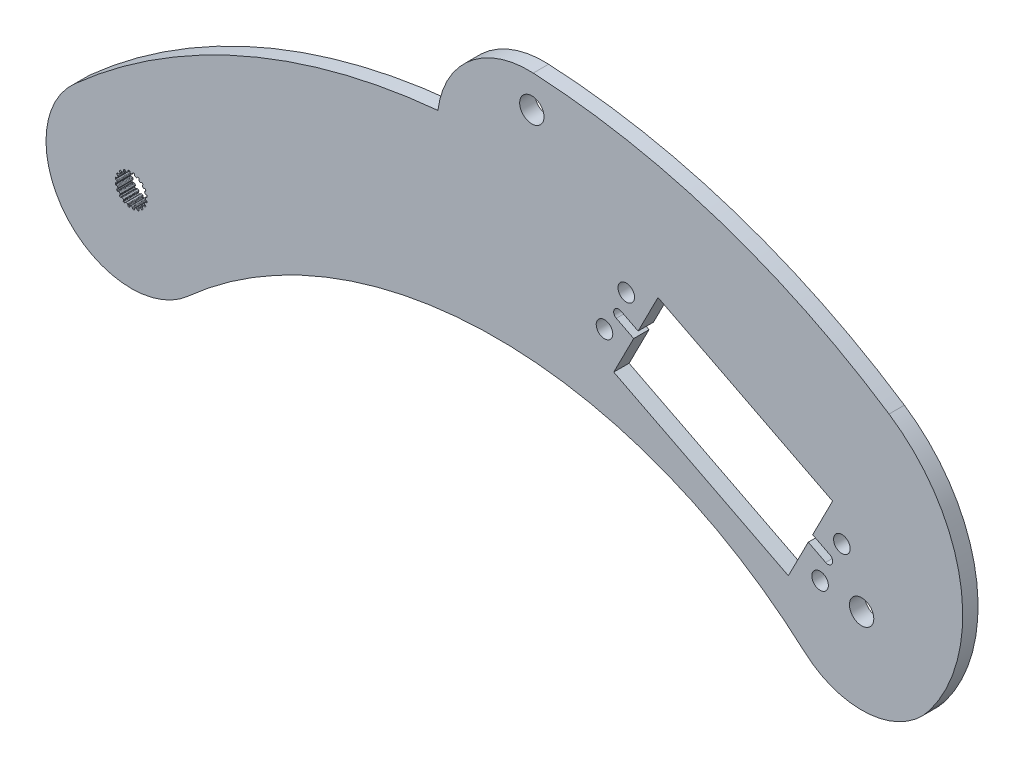
from build123d import *

# Parameters (mm, degrees)
BOSS_EXTRUDE1_DEPTH = 3.2004
SKETCH2_R           = 1.7272
SKETCH2_R_2         = 2.54
CUT_EXTRUDE1_DEPTH  = 3.2004
CUT_EXTRUDE2_DEPTH  = 3.2004
BOSS_EXTRUDE2_START = -3.2004
SKETCH4_R           = 2.54
BOSS_EXTRUDE2_DEPTH = 3.2004


with BuildPart() as part:
    # Sketch1 → Boss-Extrude1 (new body)
    with BuildSketch(Plane.XY):
        with BuildLine():
            ThreePointArc((-11.875315661, 13.236894431), (76.2, 46.954576728), (164.275315661, 13.236894431))
            ThreePointArc((164.275315661, 13.236894431), (165.636894431, -11.875315661), (140.524684339, -13.236894431))
            ThreePointArc((140.524684339, -13.236894431), (76.2, 11.388385128), (11.875315661, -13.236894431))
            ThreePointArc((11.875315661, -13.236894431), (-13.236894431, -11.875315661), (-11.875315661, 13.236894431))
        make_face()
        with BuildLine():
            Line((-0.106949245, 2.969874934), (0.106949245, 2.969874934))
            ThreePointArc((0.106949245, 2.969874934), (0.196343213, 2.986924176), (0.253739238, 3.057547504))
            Line((0.253739238, 3.057547504), (0.315888147, 3.237526941))
            ThreePointArc((0.315888147, 3.237526941), (0.359032156, 3.298322911), (0.4281449, 3.326269005))
            Line((0.4281449, 3.326269005), (0.620027588, 3.2937547))
            ThreePointArc((0.620027588, 3.2937547), (0.689621142, 3.24802576), (0.718272212, 3.169836791))
            Line((0.718272212, 3.169836791), (0.724389167, 2.979527391))
            ThreePointArc((0.724389167, 2.979527391), (0.750934762, 2.9040661), (0.816027049, 2.857568043))
            Line((0.816027049, 2.857568043), (1.019456602, 2.791469774))
            ThreePointArc((1.019456602, 2.791469774), (1.109743823, 2.780060312), (1.186154496, 2.829490741))
            Line((1.186154496, 2.829490741), (1.300878326, 2.981456288))
            ThreePointArc((1.300878326, 2.981456288), (1.360697704, 3.02594446), (1.435063648, 3.031165762))
            Line((1.435063648, 3.031165762), (1.607507455, 2.940947809))
            ThreePointArc((1.607507455, 2.940947809), (1.659563839, 2.875951412), (1.662650905, 2.792735615))
            Line((1.662650905, 2.792735615), (1.609659636, 2.609850378))
            ThreePointArc((1.609659636, 2.609850378), (1.611587176, 2.529879385), (1.659124931, 2.465542482))
            Line((1.659124931, 2.465542482), (1.832172444, 2.339816104))
            ThreePointArc((1.832172444, 2.339816104), (1.914514976, 2.301064775), (2.002460687, 2.32446371))
            Line((2.002460687, 2.32446371), (2.158529469, 2.433539921))
            ThreePointArc((2.158529469, 2.433539921), (2.229168681, 2.457365482), (2.301508367, 2.439350895))
            Line((2.301508367, 2.439350895), (2.437633293, 2.300260456))
            ThreePointArc((2.437633293, 2.300260456), (2.467056864, 2.222358901), (2.444277744, 2.14226202))
            Line((2.444277744, 2.14226202), (2.337365406, 1.984703026))
            ThreePointArc((2.337365406, 1.984703026), (2.314486209, 1.908050449), (2.339816104, 1.832172444))
            Line((2.339816104, 1.832172444), (2.465542482, 1.659124931))
            ThreePointArc((2.465542482, 1.659124931), (2.531880064, 1.596824985), (2.622752074, 1.591901975))
            Line((2.622752074, 1.591901975), (2.804888709, 1.64741171))
            ThreePointArc((2.804888709, 1.64741171), (2.879433095, 1.648242449), (2.942665411, 1.608755366))
            Line((2.942665411, 1.608755366), (3.0291466, 1.434407582))
            ThreePointArc((3.0291466, 1.434407582), (3.033057175, 1.351226417), (2.986641646, 1.282088892))
            Line((2.986641646, 1.282088892), (2.836273564, 1.165279113))
            ThreePointArc((2.836273564, 1.165279113), (2.790827206, 1.099448241), (2.791469774, 1.019456602))
            Line((2.791469774, 1.019456602), (2.857568043, 0.816027049))
            ThreePointArc((2.857568043, 0.816027049), (2.901407091, 0.736276839), (2.986310214, 0.703513784))
            Line((2.986310214, 0.703513784), (3.1766859, 0.700023363))
            ThreePointArc((3.1766859, 0.700023363), (3.247838536, 0.677777961), (3.295773863, 0.620683653))
            Line((3.295773863, 0.620683653), (3.324145932, 0.4281449))
            ThreePointArc((3.324145932, 0.4281449), (3.302160717, 0.347826477), (3.236652255, 0.29641597))
            Line((3.236652255, 0.29641597), (3.057547504, 0.231789562))
            ThreePointArc((3.057547504, 0.231789562), (2.993982591, 0.183224379), (2.969874934, 0.106949245))
            Line((2.969874934, 0.106949245), (2.969874934, -0.106949245))
            ThreePointArc((2.969874934, -0.106949245), (2.986924176, -0.196343213), (3.057547504, -0.253739238))
            Line((3.057547504, -0.253739238), (3.237526941, -0.315888147))
            ThreePointArc((3.237526941, -0.315888147), (3.298322911, -0.359032156), (3.326269005, -0.4281449))
            Line((3.326269005, -0.4281449), (3.2937547, -0.620027588))
            ThreePointArc((3.2937547, -0.620027588), (3.24802576, -0.689621142), (3.169836791, -0.718272212))
            Line((3.169836791, -0.718272212), (2.979527391, -0.724389167))
            ThreePointArc((2.979527391, -0.724389167), (2.9040661, -0.750934762), (2.857568043, -0.816027049))
            Line((2.857568043, -0.816027049), (2.791469774, -1.019456602))
            ThreePointArc((2.791469774, -1.019456602), (2.780060312, -1.109743823), (2.829490741, -1.186154496))
            Line((2.829490741, -1.186154496), (2.981456288, -1.300878326))
            ThreePointArc((2.981456288, -1.300878326), (3.02594446, -1.360697704), (3.031165762, -1.435063648))
            Line((3.031165762, -1.435063648), (2.940947809, -1.607507455))
            ThreePointArc((2.940947809, -1.607507455), (2.875951412, -1.659563839), (2.792735615, -1.662650905))
            Line((2.792735615, -1.662650905), (2.609850378, -1.609659636))
            ThreePointArc((2.609850378, -1.609659636), (2.529879385, -1.611587176), (2.465542482, -1.659124931))
            Line((2.465542482, -1.659124931), (2.339816104, -1.832172444))
            ThreePointArc((2.339816104, -1.832172444), (2.301064775, -1.914514976), (2.32446371, -2.002460687))
            Line((2.32446371, -2.002460687), (2.433539921, -2.158529469))
            ThreePointArc((2.433539921, -2.158529469), (2.457365482, -2.229168681), (2.439350895, -2.301508367))
            Line((2.439350895, -2.301508367), (2.300260456, -2.437633293))
            ThreePointArc((2.300260456, -2.437633293), (2.222358901, -2.467056864), (2.14226202, -2.444277744))
            Line((2.14226202, -2.444277744), (1.984703026, -2.337365406))
            ThreePointArc((1.984703026, -2.337365406), (1.908050449, -2.314486209), (1.832172444, -2.339816104))
            Line((1.832172444, -2.339816104), (1.659124931, -2.465542482))
            ThreePointArc((1.659124931, -2.465542482), (1.596824985, -2.531880064), (1.591901975, -2.622752074))
            Line((1.591901975, -2.622752074), (1.64741171, -2.804888709))
            ThreePointArc((1.64741171, -2.804888709), (1.648242449, -2.879433095), (1.608755366, -2.942665411))
            Line((1.608755366, -2.942665411), (1.434407582, -3.0291466))
            ThreePointArc((1.434407582, -3.0291466), (1.351226417, -3.033057175), (1.282088892, -2.986641646))
            Line((1.282088892, -2.986641646), (1.165279113, -2.836273564))
            ThreePointArc((1.165279113, -2.836273564), (1.099448241, -2.790827206), (1.019456602, -2.791469774))
            Line((1.019456602, -2.791469774), (0.816027049, -2.857568043))
            ThreePointArc((0.816027049, -2.857568043), (0.736276839, -2.901407091), (0.703513784, -2.986310214))
            Line((0.703513784, -2.986310214), (0.700023363, -3.1766859))
            ThreePointArc((0.700023363, -3.1766859), (0.677777961, -3.247838536), (0.620683653, -3.295773863))
            Line((0.620683653, -3.295773863), (0.4281449, -3.324145932))
            ThreePointArc((0.4281449, -3.324145932), (0.347826477, -3.302160717), (0.29641597, -3.236652255))
            Line((0.29641597, -3.236652255), (0.231789562, -3.057547504))
            ThreePointArc((0.231789562, -3.057547504), (0.183224379, -2.993982591), (0.106949245, -2.969874934))
            Line((0.106949245, -2.969874934), (-0.106949245, -2.969874934))
            ThreePointArc((-0.106949245, -2.969874934), (-0.196343213, -2.986924176), (-0.253739238, -3.057547504))
            Line((-0.253739238, -3.057547504), (-0.315888147, -3.237526941))
            ThreePointArc((-0.315888147, -3.237526941), (-0.359032156, -3.298322911), (-0.4281449, -3.326269005))
            Line((-0.4281449, -3.326269005), (-0.620027588, -3.2937547))
            ThreePointArc((-0.620027588, -3.2937547), (-0.689621142, -3.24802576), (-0.718272212, -3.169836791))
            Line((-0.718272212, -3.169836791), (-0.724389167, -2.979527391))
            ThreePointArc((-0.724389167, -2.979527391), (-0.750934762, -2.9040661), (-0.816027049, -2.857568043))
            Line((-0.816027049, -2.857568043), (-1.019456602, -2.791469774))
            ThreePointArc((-1.019456602, -2.791469774), (-1.109743823, -2.780060312), (-1.186154496, -2.829490741))
            Line((-1.186154496, -2.829490741), (-1.300878326, -2.981456288))
            ThreePointArc((-1.300878326, -2.981456288), (-1.360697704, -3.02594446), (-1.435063648, -3.031165762))
            Line((-1.435063648, -3.031165762), (-1.607507455, -2.940947809))
            ThreePointArc((-1.607507455, -2.940947809), (-1.659563839, -2.875951412), (-1.662650905, -2.792735615))
            Line((-1.662650905, -2.792735615), (-1.609659636, -2.609850378))
            ThreePointArc((-1.609659636, -2.609850378), (-1.611587176, -2.529879385), (-1.659124931, -2.465542482))
            Line((-1.659124931, -2.465542482), (-1.832172444, -2.339816104))
            ThreePointArc((-1.832172444, -2.339816104), (-1.914514976, -2.301064775), (-2.002460687, -2.32446371))
            Line((-2.002460687, -2.32446371), (-2.158529469, -2.433539921))
            ThreePointArc((-2.158529469, -2.433539921), (-2.229168681, -2.457365482), (-2.301508367, -2.439350895))
            Line((-2.301508367, -2.439350895), (-2.437633293, -2.300260456))
            ThreePointArc((-2.437633293, -2.300260456), (-2.467056864, -2.222358901), (-2.444277744, -2.14226202))
            Line((-2.444277744, -2.14226202), (-2.337365406, -1.984703026))
            ThreePointArc((-2.337365406, -1.984703026), (-2.314486209, -1.908050449), (-2.339816104, -1.832172444))
            Line((-2.339816104, -1.832172444), (-2.465542482, -1.659124931))
            ThreePointArc((-2.465542482, -1.659124931), (-2.531880064, -1.596824985), (-2.622752074, -1.591901975))
            Line((-2.622752074, -1.591901975), (-2.804888709, -1.64741171))
            ThreePointArc((-2.804888709, -1.64741171), (-2.879433095, -1.648242449), (-2.942665411, -1.608755366))
            Line((-2.942665411, -1.608755366), (-3.0291466, -1.434407582))
            ThreePointArc((-3.0291466, -1.434407582), (-3.033057175, -1.351226417), (-2.986641646, -1.282088892))
            Line((-2.986641646, -1.282088892), (-2.836273564, -1.165279113))
            ThreePointArc((-2.836273564, -1.165279113), (-2.790827206, -1.099448241), (-2.791469774, -1.019456602))
            Line((-2.791469774, -1.019456602), (-2.857568043, -0.816027049))
            ThreePointArc((-2.857568043, -0.816027049), (-2.901407091, -0.736276839), (-2.986310214, -0.703513784))
            Line((-2.986310214, -0.703513784), (-3.1766859, -0.700023363))
            ThreePointArc((-3.1766859, -0.700023363), (-3.247838536, -0.677777961), (-3.295773863, -0.620683653))
            Line((-3.295773863, -0.620683653), (-3.324145932, -0.4281449))
            ThreePointArc((-3.324145932, -0.4281449), (-3.302160717, -0.347826477), (-3.236652255, -0.29641597))
            Line((-3.236652255, -0.29641597), (-3.057547504, -0.231789562))
            ThreePointArc((-3.057547504, -0.231789562), (-2.993982591, -0.183224379), (-2.969874934, -0.106949245))
            Line((-2.969874934, -0.106949245), (-2.969874934, 0.106949245))
            ThreePointArc((-2.969874934, 0.106949245), (-2.986924176, 0.196343213), (-3.057547504, 0.253739238))
            Line((-3.057547504, 0.253739238), (-3.237526941, 0.315888147))
            ThreePointArc((-3.237526941, 0.315888147), (-3.298322911, 0.359032156), (-3.326269005, 0.4281449))
            Line((-3.326269005, 0.4281449), (-3.2937547, 0.620027588))
            ThreePointArc((-3.2937547, 0.620027588), (-3.24802576, 0.689621142), (-3.169836791, 0.718272212))
            Line((-3.169836791, 0.718272212), (-2.979527391, 0.724389167))
            ThreePointArc((-2.979527391, 0.724389167), (-2.9040661, 0.750934762), (-2.857568043, 0.816027049))
            Line((-2.857568043, 0.816027049), (-2.791469774, 1.019456602))
            ThreePointArc((-2.791469774, 1.019456602), (-2.780060312, 1.109743823), (-2.829490741, 1.186154496))
            Line((-2.829490741, 1.186154496), (-2.981456288, 1.300878326))
            ThreePointArc((-2.981456288, 1.300878326), (-3.02594446, 1.360697704), (-3.031165762, 1.435063648))
            Line((-3.031165762, 1.435063648), (-2.940947809, 1.607507455))
            ThreePointArc((-2.940947809, 1.607507455), (-2.875951412, 1.659563839), (-2.792735615, 1.662650905))
            Line((-2.792735615, 1.662650905), (-2.609850378, 1.609659636))
            ThreePointArc((-2.609850378, 1.609659636), (-2.529879385, 1.611587176), (-2.465542482, 1.659124931))
            Line((-2.465542482, 1.659124931), (-2.339816104, 1.832172444))
            ThreePointArc((-2.339816104, 1.832172444), (-2.301064775, 1.914514976), (-2.32446371, 2.002460687))
            Line((-2.32446371, 2.002460687), (-2.433539921, 2.158529469))
            ThreePointArc((-2.433539921, 2.158529469), (-2.457365482, 2.229168681), (-2.439350895, 2.301508367))
            Line((-2.439350895, 2.301508367), (-2.300260456, 2.437633293))
            ThreePointArc((-2.300260456, 2.437633293), (-2.222358901, 2.467056864), (-2.14226202, 2.444277744))
            Line((-2.14226202, 2.444277744), (-1.984703026, 2.337365406))
            ThreePointArc((-1.984703026, 2.337365406), (-1.908050449, 2.314486209), (-1.832172444, 2.339816104))
            Line((-1.832172444, 2.339816104), (-1.659124931, 2.465542482))
            ThreePointArc((-1.659124931, 2.465542482), (-1.596824985, 2.531880064), (-1.591901975, 2.622752074))
            Line((-1.591901975, 2.622752074), (-1.64741171, 2.804888709))
            ThreePointArc((-1.64741171, 2.804888709), (-1.648242449, 2.879433095), (-1.608755366, 2.942665411))
            Line((-1.608755366, 2.942665411), (-1.434407582, 3.0291466))
            ThreePointArc((-1.434407582, 3.0291466), (-1.351226417, 3.033057175), (-1.282088892, 2.986641646))
            Line((-1.282088892, 2.986641646), (-1.165279113, 2.836273564))
            ThreePointArc((-1.165279113, 2.836273564), (-1.099448241, 2.790827206), (-1.019456602, 2.791469774))
            Line((-1.019456602, 2.791469774), (-0.816027049, 2.857568043))
            ThreePointArc((-0.816027049, 2.857568043), (-0.736276839, 2.901407091), (-0.703513784, 2.986310214))
            Line((-0.703513784, 2.986310214), (-0.700023363, 3.1766859))
            ThreePointArc((-0.700023363, 3.1766859), (-0.677777961, 3.247838536), (-0.620683653, 3.295773863))
            Line((-0.620683653, 3.295773863), (-0.4281449, 3.324145932))
            ThreePointArc((-0.4281449, 3.324145932), (-0.347826477, 3.302160717), (-0.29641597, 3.236652255))
            Line((-0.29641597, 3.236652255), (-0.231789562, 3.057547504))
            ThreePointArc((-0.231789562, 3.057547504), (-0.183224379, 2.993982591), (-0.106949245, 2.969874934))
        make_face(mode=Mode.SUBTRACT)
    extrude(amount=BOSS_EXTRUDE1_DEPTH)

    # Sketch2 → Cut-Extrude1 (cut)
    with BuildSketch(Plane.XY.offset(3.2004)):
        with Locations((103.294155033, 33.130546269)):
            Circle(SKETCH2_R)
        with Locations((143.733546084, 1.272962356)):
            Circle(SKETCH2_R)
        with Locations((148.278076154, 10.180669567)):
            Circle(SKETCH2_R)
        with Locations((98.749624963, 24.222839057)):
            Circle(SKETCH2_R)
        with Locations((152.4, 0)):
            Circle(SKETCH2_R_2)
        Polygon((109.917504264, 35.544185352), (146.344681894, 16.959784207), (137.110196853, -1.140676727), (100.683019223, 17.443724418), align=None)
    extrude(amount=-CUT_EXTRUDE1_DEPTH, mode=Mode.SUBTRACT)

    # Sketch3 → Cut-Extrude2 (cut)
    with BuildSketch(Plane.XY.offset(3.2004)):
        with BuildLine():
            Line((102.141893809, 29.24587494), (105.761985996, 27.398977932))
            Line((105.761985996, 27.398977932), (104.838537492, 25.588931838))
            Line((104.838537492, 25.588931838), (101.218445305, 27.435828846))
            ThreePointArc((101.218445305, 27.435828846), (100.77514651, 28.802576145), (102.141893809, 29.24587494))
        make_face()
        with BuildLine():
            Line((142.189163626, 8.814576786), (145.809255813, 6.967679778))
            ThreePointArc((145.809255813, 6.967679778), (146.252554607, 5.60093248), (144.885807308, 5.157633685))
            Line((144.885807308, 5.157633685), (141.265715122, 7.004530693))
            Line((141.265715122, 7.004530693), (142.189163626, 8.814576786))
        make_face()
    extrude(amount=-CUT_EXTRUDE2_DEPTH, mode=Mode.SUBTRACT)

    # Sketch4 → Boss-Extrude2 (add)
    with BuildSketch(Plane.XY.offset(3.2004).offset(BOSS_EXTRUDE2_START)):
        with BuildLine():
            ThreePointArc((63.994452175, 46.388596865), (70.655775204, 58.652872993), (83.889992464, 63.08471087))
            ThreePointArc((83.889992464, 63.08471087), (122.650665385, 55.817735997), (158.123143389, 38.586891754))
            ThreePointArc((158.123143389, 38.586891754), (172.994139846, 15.795725761), (166.631162232, -10.663607165))
            ThreePointArc((166.631162232, -10.663607165), (170.097331469, 1.744406806), (164.275315661, 13.236894431))
            ThreePointArc((164.275315661, 13.236894431), (117.598239835, 40.289080087), (63.994452175, 46.388596865))
        make_face()
        with Locations((83.588077125, 56.286137461)):
            Circle(SKETCH4_R, mode=Mode.SUBTRACT)
    extrude(amount=BOSS_EXTRUDE2_DEPTH)


solid = part.part
